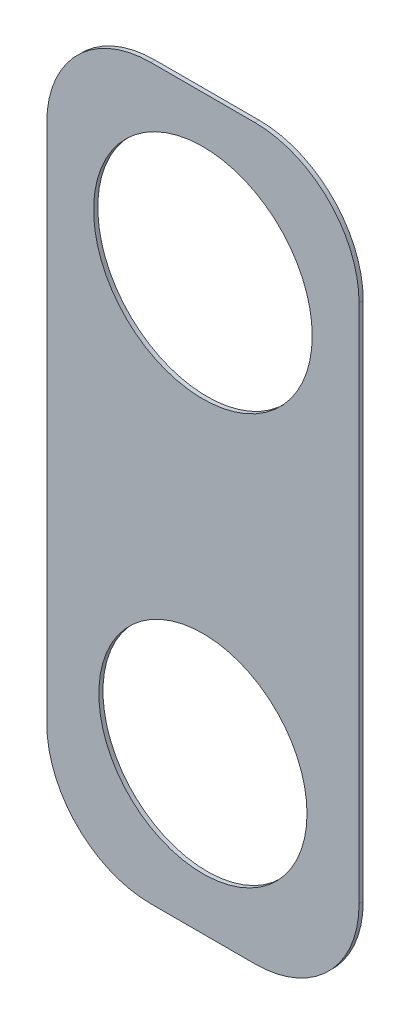
from build123d import *

# Parameters (mm, degrees)
SKETCH2_R           = 13.335
SKETCH2_R_2         = 12.7
BOSS_EXTRUDE1_DEPTH = 0.508


with BuildPart() as part:
    # Sketch2 → Boss-Extrude1 (new body)
    with BuildSketch(Plane.XY):
        with BuildLine():
            Line((12.7, 0), (25.4, 0))
            ThreePointArc((25.4, 0), (34.380256121, 3.719743879), (38.1, 12.7))
            Line((38.1, 12.7), (38.1, 76.2))
            ThreePointArc((38.1, 76.2), (34.380256121, 85.180256121), (25.4, 88.9))
            Line((25.4, 88.9), (12.7, 88.9))
            ThreePointArc((12.7, 88.9), (3.719743879, 85.180256121), (0, 76.2))
            Line((0, 76.2), (0, 12.7))
            ThreePointArc((0, 12.7), (3.719743879, 3.719743879), (12.7, 0))
        make_face()
        with Locations((19.05, 69.85)):
            Circle(SKETCH2_R, mode=Mode.SUBTRACT)
        with Locations((19.05, 19.05)):
            Circle(SKETCH2_R_2, mode=Mode.SUBTRACT)
    extrude(amount=BOSS_EXTRUDE1_DEPTH)


solid = part.part
